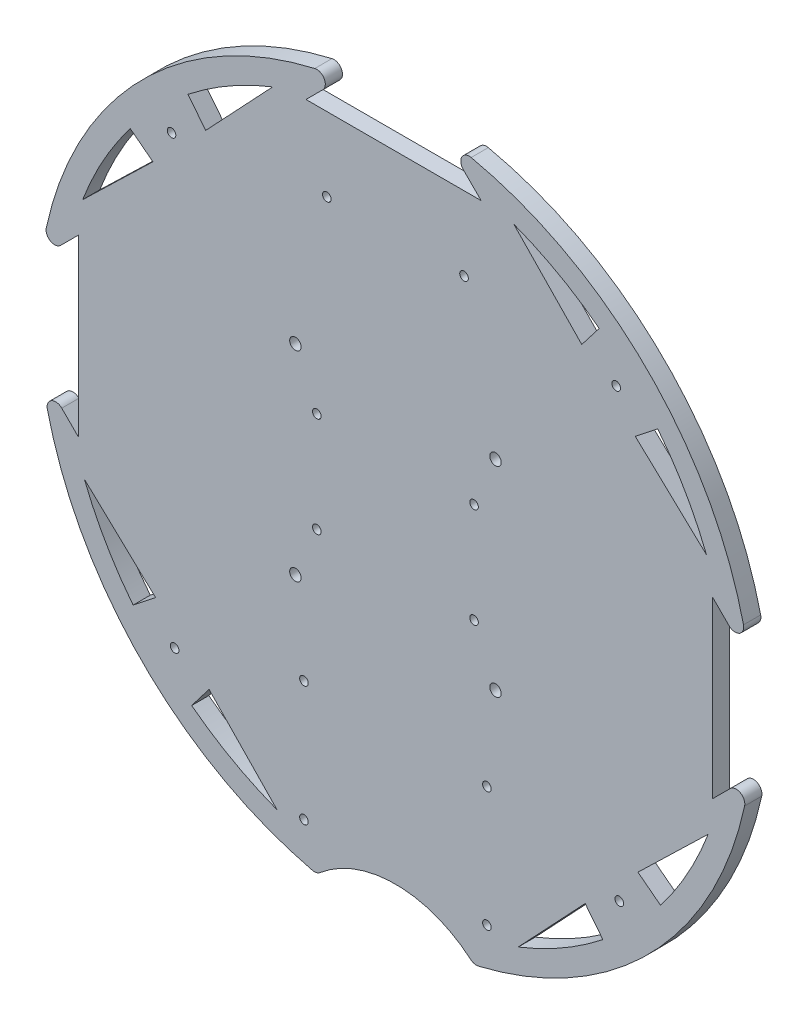
from build123d import *

# Parameters (mm, degrees)
SKETCH_1_R      = 1.5
SKETCH_1_R_2    = 2
EXTRUDE_1_DEPTH = 6


with BuildPart() as part:
    # 草图1 → 凸台-拉伸1 (new body)
    with BuildSketch(Plane.XY):
        with BuildLine():
            Line((0, 110.847244413), (30, 110.847244413))
            Line((30, 110.847244413), (23.741384574, 117.105859839))
            ThreePointArc((23.741384574, 117.105859839), (23.229244404, 120.664151209), (26.498673071, 122.158996089))
            ThreePointArc((26.498673071, 122.158996089), (87.76795333, 89.00441769), (121.776362518, 28.20492035))
            ThreePointArc((121.776362518, 28.20492035), (120.309085428, 24.90465706), (116.732409474, 25.406681918))
            Line((116.732409474, 25.406681918), (110.847244413, 31.291846979))
            Line((110.847244413, 31.291846979), (110.847244413, 0))
            Line((110.847244413, 0), (110.847244413, -30))
            Line((110.847244413, -30), (117.105859839, -23.741384574))
            ThreePointArc((117.105859839, -23.741384574), (120.664151209, -23.229244404), (122.158996089, -26.498673071))
            ThreePointArc((122.158996089, -26.498673071), (89.29937265, -87.467834341), (29.024164684, -121.583707233))
            ThreePointArc((29.024164684, -121.583707233), (27.627313844, -121.582823674), (26.382281192, -120.949509578))
            ThreePointArc((26.382281192, -120.949509578), (0, -111.236531221), (-26.382281192, -120.949509578))
            ThreePointArc((-26.382281192, -120.949509578), (-27.627313844, -121.582823674), (-29.024164684, -121.583707233))
            ThreePointArc((-29.024164684, -121.583707233), (-88.685394575, -88.090299063), (-121.776362518, -28.20492035))
            ThreePointArc((-121.776362518, -28.20492035), (-120.309085428, -24.90465706), (-116.732409474, -25.406681918))
            Line((-116.732409474, -25.406681918), (-110.847244413, -31.291846979))
            Line((-110.847244413, -31.291846979), (-110.847244413, 0))
            Line((-110.847244413, 0), (-110.847244413, 30))
            Line((-110.847244413, 30), (-117.105859839, 23.741384574))
            ThreePointArc((-117.105859839, 23.741384574), (-120.664151209, 23.229244404), (-122.158996089, 26.498673071))
            ThreePointArc((-122.158996089, 26.498673071), (-89.00441769, 87.76795333), (-28.20492035, 121.776362518))
            ThreePointArc((-28.20492035, 121.776362518), (-24.90465706, 120.309085428), (-25.406681918, 116.732409474))
            Line((-25.406681918, 116.732409474), (-31.291846979, 110.847244413))
            Line((-31.291846979, 110.847244413), (0, 110.847244413))
        make_face()
        with Locations((27.5, 17.5)):
            Circle(SKETCH_1_R, mode=Mode.SUBTRACT)
        with Locations((35, 35)):
            Circle(SKETCH_1_R_2, mode=Mode.SUBTRACT)
        with Locations((-35, 35)):
            Circle(SKETCH_1_R_2, mode=Mode.SUBTRACT)
        with Locations((-35, -35)):
            Circle(SKETCH_1_R_2, mode=Mode.SUBTRACT)
        with Locations((35, -35)):
            Circle(SKETCH_1_R_2, mode=Mode.SUBTRACT)
        with Locations((-27.5, 17.5)):
            Circle(SKETCH_1_R, mode=Mode.SUBTRACT)
        with Locations((27.5, -17.5)):
            Circle(SKETCH_1_R, mode=Mode.SUBTRACT)
        with Locations((-27.5, -17.5)):
            Circle(SKETCH_1_R, mode=Mode.SUBTRACT)
        with Locations((32, -65.646566025)):
            Circle(SKETCH_1_R, mode=Mode.SUBTRACT)
        with Locations((-32, -65.646566025)):
            Circle(SKETCH_1_R, mode=Mode.SUBTRACT)
        with Locations((32, -107.646566025)):
            Circle(SKETCH_1_R, mode=Mode.SUBTRACT)
        with Locations((-32, -107.646566025)):
            Circle(SKETCH_1_R, mode=Mode.SUBTRACT)
        with Locations((24, 85)):
            Circle(SKETCH_1_R, mode=Mode.SUBTRACT)
        with Locations((-24, 85)):
            Circle(SKETCH_1_R, mode=Mode.SUBTRACT)
        with Locations((77.23579893, 78.323887567)):
            Circle(SKETCH_1_R, mode=Mode.SUBTRACT)
        with Locations((78.323887567, -77.23579893)):
            Circle(SKETCH_1_R, mode=Mode.SUBTRACT)
        with Locations((-77.23579893, -78.323887567)):
            Circle(SKETCH_1_R, mode=Mode.SUBTRACT)
        with Locations((-78.323887567, 77.23579893)):
            Circle(SKETCH_1_R, mode=Mode.SUBTRACT)
        with BuildLine():
            Line((72.581523243, -91.765584419), (66.377974248, -83.922372075))
            Line((66.377974248, -83.922372075), (42.940005539, -108.835453435))
            ThreePointArc((42.940005539, -108.835453435), (58.387935484, -101.389590146), (72.581523243, -91.765584419))
        make_face(mode=Mode.SUBTRACT)
        with BuildLine():
            Line((91.765584419, 72.581523243), (83.922372075, 66.377974248))
            Line((83.922372075, 66.377974248), (108.835453435, 42.940005539))
            ThreePointArc((108.835453435, 42.940005539), (101.389590146, 58.387935484), (91.765584419, 72.581523243))
        make_face(mode=Mode.SUBTRACT)
        with BuildLine():
            Line((65.197518305, 84.842699196), (41.413342405, 109.425477248))
            ThreePointArc((41.413342405, 109.425477248), (56.963918445, 102.196438272), (71.290744315, 92.77192342))
            Line((71.290744315, 92.77192342), (65.197518305, 84.842699196))
        make_face(mode=Mode.SUBTRACT)
        with BuildLine():
            Line((84.842699196, -65.197518305), (109.425477248, -41.413342405))
            ThreePointArc((109.425477248, -41.413342405), (102.196438272, -56.963918445), (92.77192342, -71.290744315))
            Line((92.77192342, -71.290744315), (84.842699196, -65.197518305))
        make_face(mode=Mode.SUBTRACT)
        with BuildLine():
            Line((-91.765584419, -72.581523243), (-83.922372075, -66.377974248))
            Line((-83.922372075, -66.377974248), (-108.835453435, -42.940005539))
            ThreePointArc((-108.835453435, -42.940005539), (-101.389590146, -58.387935484), (-91.765584419, -72.581523243))
        make_face(mode=Mode.SUBTRACT)
        with BuildLine():
            Line((-65.197518305, -84.842699196), (-41.413342405, -109.425477248))
            ThreePointArc((-41.413342405, -109.425477248), (-56.963918445, -102.196438272), (-71.290744315, -92.77192342))
            Line((-71.290744315, -92.77192342), (-65.197518305, -84.842699196))
        make_face(mode=Mode.SUBTRACT)
        with BuildLine():
            Line((-72.581523243, 91.765584419), (-66.377974248, 83.922372075))
            Line((-66.377974248, 83.922372075), (-42.940005539, 108.835453435))
            ThreePointArc((-42.940005539, 108.835453435), (-58.387935484, 101.389590146), (-72.581523243, 91.765584419))
        make_face(mode=Mode.SUBTRACT)
        with BuildLine():
            Line((-84.842699196, 65.197518305), (-109.425477248, 41.413342405))
            ThreePointArc((-109.425477248, 41.413342405), (-102.196438272, 56.963918445), (-92.77192342, 71.290744315))
            Line((-92.77192342, 71.290744315), (-84.842699196, 65.197518305))
        make_face(mode=Mode.SUBTRACT)
    extrude(amount=EXTRUDE_1_DEPTH)


solid = part.part
